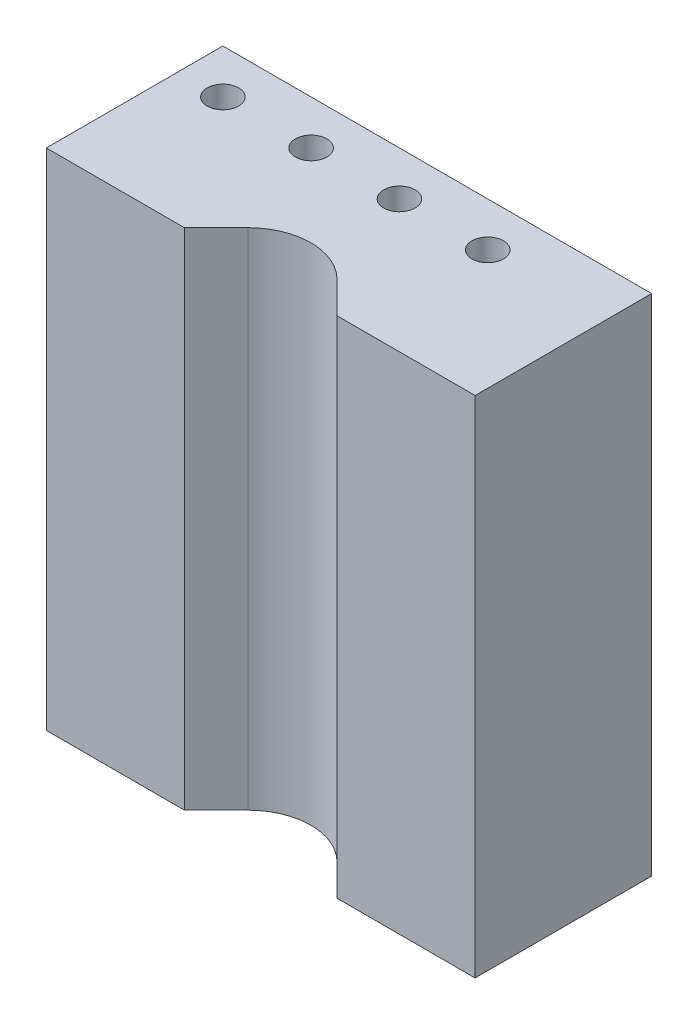
from build123d import *

# Parameters (mm, degrees)
SKETCH_1_R          = 1.25
EXTRUDE_1_DEPTH     = 40
SKETCH_2_R          = 1.25
EXTRUDE_2_DEPTH     = 30
SKETCH_2_3_R        = 1.25
CUT_EXTRUDE_1_DEPTH = 10
EXTRUDE_START       = -10
EXTRUDE_3_DEPTH     = 10
CUT_EXTRUDE_START   = -15
SKETCH_4_R          = 1.25
CUT_EXTRUDE_2_DEPTH = 15
SKETCH_5_R          = 1.25
CUT_EXTRUDE_3_DEPTH = 15
EXTRUDE_4_DEPTH     = 40


with BuildPart() as part:
    # 草图1 → 凸台-拉伸1 (new body)
    with BuildSketch(Plane(origin=(0, 0, 0), x_dir=(1, 0, 0), z_dir=(0, 1, 0))):
        Polygon((-3.5, 3.5), (-3.5, -10.5), (1.449747468, -10.5), (7.449747468, -10.5), (13.495730206, -4.454017262), (13.504269794, -4.454017262), (19.550252532, -10.5), (24.5, -10.5), (30.5, -10.5), (30.5, 3.5), (24.5, 3.5), align=None)
        with Locations(Location((0, 0, 0), (0, 0, 270))):
            Circle(SKETCH_1_R, mode=Mode.SUBTRACT)
        with Locations(Location((7, 0, 0), (0, 0, 270))):
            Circle(SKETCH_1_R, mode=Mode.SUBTRACT)
        with Locations(Location((14, 0, 0), (0, 0, 270))):
            Circle(SKETCH_1_R, mode=Mode.SUBTRACT)
        with Locations(Location((21, 0, 0), (0, 0, 270))):
            Circle(SKETCH_1_R, mode=Mode.SUBTRACT)
        with Locations(Location((21, -7, 0), (0, 0, 270))):
            Circle(SKETCH_1_R, mode=Mode.SUBTRACT)
        with Locations(Location((0, -7, 0), (0, 0, 270))):
            Circle(SKETCH_1_R, mode=Mode.SUBTRACT)
    extrude(amount=EXTRUDE_1_DEPTH)

    # 草图2 → 凸台-拉伸2 (add)
    with BuildSketch(Plane.XZ):
        with Locations(Location((0, 7, 0), (0, 0, 270))):
            Circle(SKETCH_2_R)
        with Locations(Location((0, 0, 0), (0, 0, 270))):
            Circle(SKETCH_2_R)
        with Locations((6, 0)):
            Circle(SKETCH_2_R)
        with Locations(Location((7, 0, 0), (0, 0, 270))):
            Circle(SKETCH_2_R)
        with Locations((13, 0)):
            Circle(SKETCH_2_R)
        with Locations(Location((14, 0, 0), (0, 0, 270))):
            Circle(SKETCH_2_R)
        with Locations((20, 0)):
            Circle(SKETCH_2_R)
        with Locations(Location((21, 0, 0), (0, 0, 270))):
            Circle(SKETCH_2_R)
        with Locations(Location((21, 7, 0), (0, 0, 270))):
            Circle(SKETCH_2_R)
    extrude(amount=-EXTRUDE_2_DEPTH)

    # 草图2<3> → 切除-拉伸1 (cut)
    with BuildSketch(Plane.XZ):
        with Locations(Location((27, 7, 0), (0, 0, 270))):
            Circle(SKETCH_2_3_R)
        with Locations(Location((27, 0, 0), (0, 0, 270))):
            Circle(SKETCH_2_3_R)
        with Locations(Location((20, 0, 0), (0, 0, 270))):
            Circle(SKETCH_2_3_R)
        with Locations(Location((13, 0, 0), (0, 0, 270))):
            Circle(SKETCH_2_3_R)
        with Locations(Location((6, 0, 0), (0, 0, 270))):
            Circle(SKETCH_2_3_R)
        with Locations(Location((6, 7, 0), (0, 0, 270))):
            Circle(SKETCH_2_3_R)
    extrude(amount=-CUT_EXTRUDE_1_DEPTH, mode=Mode.SUBTRACT)

    # 草图3 → 凸台-拉伸3 (add)
    with BuildSketch(Plane(origin=(0, 40, 0), x_dir=(1, 0, 0), z_dir=(0, 1, 0)).offset(EXTRUDE_START)):
        with BuildLine():
            ThreePointArc((1.124456691, -6.454017262), (0, -5.75), (-1.124456691, -6.454017262))
            Line((-1.124456691, -6.454017262), (1.124456691, -6.454017262))
        make_face()
        with BuildLine():
            Line((1.124456691, -6.454017262), (-1.124456691, -6.454017262))
            ThreePointArc((-1.124456691, -6.454017262), (-0.280115276, -8.218209929), (1.25, -7))
            ThreePointArc((1.25, -7), (1.218209929, -6.719884724), (1.124456691, -6.454017262))
        make_face()
        with BuildLine():
            ThreePointArc((22.25, -7), (22.218209929, -6.719884724), (22.124456691, -6.454017262))
            Line((22.124456691, -6.454017262), (19.875543309, -6.454017262))
            ThreePointArc((19.875543309, -6.454017262), (20.719884724, -8.218209929), (22.25, -7))
        make_face()
        with BuildLine():
            Line((19.875543309, -6.454017262), (22.124456691, -6.454017262))
            ThreePointArc((22.124456691, -6.454017262), (21, -5.75), (19.875543309, -6.454017262))
        make_face()
    extrude(amount=EXTRUDE_3_DEPTH)

    # 草图4 → 切除-拉伸2 (cut)
    with BuildSketch(Plane(origin=(0, 40, 0), x_dir=(1, 0, 0), z_dir=(0, 1, 0)).offset(CUT_EXTRUDE_START)):
        with Locations(Location((21, 0, 0), (0, 0, 270))):
            Circle(SKETCH_4_R)
        with Locations(Location((14, 0, 0), (0, 0, 270))):
            Circle(SKETCH_4_R)
        with Locations(Location((7, 0, 0), (0, 0, 270))):
            Circle(SKETCH_4_R)
        with Locations(Location((0, 0, 0), (0, 0, 270))):
            Circle(SKETCH_4_R)
    extrude(amount=CUT_EXTRUDE_2_DEPTH, mode=Mode.SUBTRACT)

    # 草图5 → 切除-拉伸3 (cut)
    with BuildSketch(Plane.XZ):
        with Locations(Location((6, 7, 0), (0, 0, 270))):
            Circle(SKETCH_5_R)
        with Locations(Location((27, 7, 0), (0, 0, 270))):
            Circle(SKETCH_5_R)
        with Locations(Location((27, 0, 0), (0, 0, 270))):
            Circle(SKETCH_5_R)
        with Locations(Location((20, 0, 0), (0, 0, 270))):
            Circle(SKETCH_5_R)
        with Locations(Location((13, 0, 0), (0, 0, 270))):
            Circle(SKETCH_5_R)
        with Locations(Location((6, 0, 0), (0, 0, 270))):
            Circle(SKETCH_5_R)
    extrude(amount=-CUT_EXTRUDE_3_DEPTH, mode=Mode.SUBTRACT)

    # 草图6 → 凸台-拉伸4 (add)
    with BuildSketch(Plane(origin=(0, 40, 0), x_dir=(1, 0, 0), z_dir=(0, 1, 0))):
        with BuildLine():
            Line((13.504269794, -4.454017262), (13.495730206, -4.454017262))
            Line((13.495730206, -4.454017262), (9.964466094, -7.985281374))
            ThreePointArc((9.964466094, -7.985281374), (13.5, -6.52081528), (17.035533906, -7.985281374))
            Line((17.035533906, -7.985281374), (13.504269794, -4.454017262))
        make_face()
    extrude(amount=-EXTRUDE_4_DEPTH)


solid = part.part
